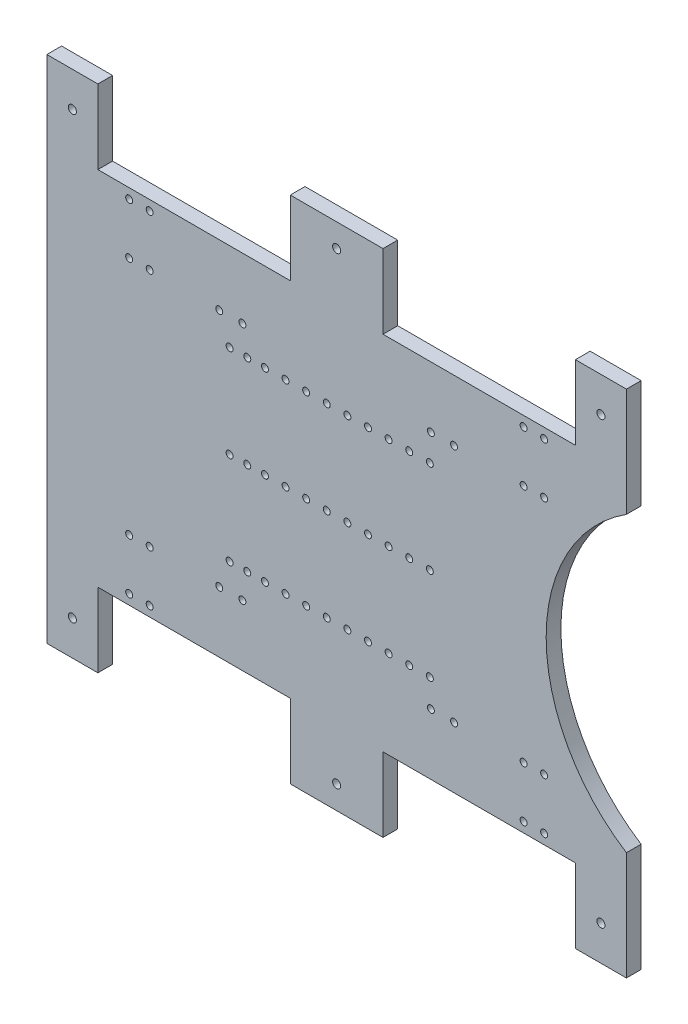
from build123d import *

# Parameters (mm, degrees)
SKETCH1_R           = 1.7525
SKETCH1_R_2         = 1.5
BOSS_EXTRUDE1_DEPTH = 6.35
SKETCH3_R           = 1.5
CUT_EXTRUDE2_DEPTH  = 10


with BuildPart() as part:
    # Sketch1 → Boss-Extrude1 (new body)
    with BuildSketch(Plane.XY):
        with BuildLine():
            Line((119.609790965, 110), (97.609790965, 110))
            Line((97.609790965, 110), (97.609790965, 78))
            Line((97.609790965, 78), (14.609790965, 78))
            Line((14.609790965, 78), (14.609790965, 110))
            Line((14.609790965, 110), (-25.390209035, 110))
            Line((-25.390209035, 110), (-25.390209035, 78))
            Line((-25.390209035, 78), (-108.390209035, 78))
            Line((-108.390209035, 78), (-108.390209035, 110))
            Line((-108.390209035, 110), (-130.390209035, 110))
            Line((-130.390209035, 110), (-130.390209035, -110))
            Line((-130.390209035, -110), (-108.390209035, -110))
            Line((-108.390209035, -110), (-108.390209035, -78))
            Line((-108.390209035, -78), (-25.390209035, -78))
            Line((-25.390209035, -78), (-25.390209035, -110))
            Line((-25.390209035, -110), (14.609790965, -110))
            Line((14.609790965, -110), (14.609790965, -78))
            Line((14.609790965, -78), (97.609790965, -78))
            Line((97.609790965, -78), (97.609790965, -110))
            Line((97.609790965, -110), (119.609790965, -110))
            Line((119.609790965, -110), (119.609790965, -63.2))
            ThreePointArc((119.609790965, -63.2), (84.992460515, 0), (119.609790965, 63.2))
            Line((119.609790965, 63.2), (119.609790965, 110))
        make_face()
        with Locations((-119.390209035, 95)):
            Circle(SKETCH1_R, mode=Mode.SUBTRACT)
        with Locations(Location((108.609790965, 95, 0), (0, 0, 180))):
            Circle(SKETCH1_R, mode=Mode.SUBTRACT)
        with Locations((-5.390209035, 100)):
            Circle(SKETCH1_R, mode=Mode.SUBTRACT)
        with Locations(Location((-5.390209035, -100, 0), (0, 0, 180))):
            Circle(SKETCH1_R, mode=Mode.SUBTRACT)
        with Locations((108.609790965, -95)):
            Circle(SKETCH1_R, mode=Mode.SUBTRACT)
        with Locations(Location((-119.390209035, -95, 0), (0, 0, 180))):
            Circle(SKETCH1_R, mode=Mode.SUBTRACT)
        with Locations((-36.311771099, 40)):
            Circle(SKETCH1_R_2, mode=Mode.SUBTRACT)
        with Locations((-36.311771099, 0)):
            Circle(SKETCH1_R_2, mode=Mode.SUBTRACT)
        with Locations(Location((-36.311771099, -40, 0), (0, 0, 180))):
            Circle(SKETCH1_R_2, mode=Mode.SUBTRACT)
        with Locations(Location((-27.421771099, -40, 0), (0, 0, 180))):
            Circle(SKETCH1_R_2, mode=Mode.SUBTRACT)
        with Locations((-27.421771099, 0)):
            Circle(SKETCH1_R_2, mode=Mode.SUBTRACT)
        with Locations((-27.421771099, 40)):
            Circle(SKETCH1_R_2, mode=Mode.SUBTRACT)
        with Locations(Location((-18.531771099, -40, 0), (0, 0, 180))):
            Circle(SKETCH1_R_2, mode=Mode.SUBTRACT)
        with Locations((-18.531771099, 0)):
            Circle(SKETCH1_R_2, mode=Mode.SUBTRACT)
        with Locations((-18.531771099, 40)):
            Circle(SKETCH1_R_2, mode=Mode.SUBTRACT)
        with Locations(Location((-9.641771099, -40, 0), (0, 0, 180))):
            Circle(SKETCH1_R_2, mode=Mode.SUBTRACT)
        with Locations((-9.641771099, 0)):
            Circle(SKETCH1_R_2, mode=Mode.SUBTRACT)
        with Locations((-9.641771099, 40)):
            Circle(SKETCH1_R_2, mode=Mode.SUBTRACT)
        with Locations(Location((-0.751771099, -40, 0), (0, 0, 180))):
            Circle(SKETCH1_R_2, mode=Mode.SUBTRACT)
        with Locations((-0.751771099, 0)):
            Circle(SKETCH1_R_2, mode=Mode.SUBTRACT)
        with Locations((-0.751771099, 40)):
            Circle(SKETCH1_R_2, mode=Mode.SUBTRACT)
        with Locations(Location((8.138228901, -40, 0), (0, 0, 180))):
            Circle(SKETCH1_R_2, mode=Mode.SUBTRACT)
        with Locations((8.138228901, 0)):
            Circle(SKETCH1_R_2, mode=Mode.SUBTRACT)
        with Locations((8.138228901, 40)):
            Circle(SKETCH1_R_2, mode=Mode.SUBTRACT)
        with Locations(Location((17.028228901, -40, 0), (0, 0, 180))):
            Circle(SKETCH1_R_2, mode=Mode.SUBTRACT)
        with Locations((17.028228901, 0)):
            Circle(SKETCH1_R_2, mode=Mode.SUBTRACT)
        with Locations((17.028228901, 40)):
            Circle(SKETCH1_R_2, mode=Mode.SUBTRACT)
        with Locations(Location((25.918228901, -40, 0), (0, 0, 180))):
            Circle(SKETCH1_R_2, mode=Mode.SUBTRACT)
        with Locations((25.918228901, 0)):
            Circle(SKETCH1_R_2, mode=Mode.SUBTRACT)
        with Locations((25.918228901, 40)):
            Circle(SKETCH1_R_2, mode=Mode.SUBTRACT)
        with Locations(Location((34.808228901, -40, 0), (0, 0, 180))):
            Circle(SKETCH1_R_2, mode=Mode.SUBTRACT)
        with Locations((34.808228901, 0)):
            Circle(SKETCH1_R_2, mode=Mode.SUBTRACT)
        with Locations((34.808228901, 40)):
            Circle(SKETCH1_R_2, mode=Mode.SUBTRACT)
        with Locations((-43.931771099, 0)):
            Circle(SKETCH1_R_2, mode=Mode.SUBTRACT)
        with Locations(Location((-43.931771099, -40, 0), (0, 0, 180))):
            Circle(SKETCH1_R_2, mode=Mode.SUBTRACT)
        with Locations((-43.931771099, 40)):
            Circle(SKETCH1_R_2, mode=Mode.SUBTRACT)
        with Locations((-51.551771099, 0)):
            Circle(SKETCH1_R_2, mode=Mode.SUBTRACT)
        with Locations(Location((-51.551771099, -40, 0), (0, 0, 180))):
            Circle(SKETCH1_R_2, mode=Mode.SUBTRACT)
        with Locations((-51.551771099, 40)):
            Circle(SKETCH1_R_2, mode=Mode.SUBTRACT)
    extrude(amount=BOSS_EXTRUDE1_DEPTH)

    # Sketch3 → Cut-Extrude2 (cut)
    with BuildSketch(Plane.XY.offset(6.35)):
        with Locations((-86.040209035, 73.7)):
            Circle(SKETCH3_R)
        with Locations((-86.040209035, 51.7)):
            Circle(SKETCH3_R)
        with Locations((-56.040209035, 51.7)):
            Circle(SKETCH3_R)
        with Locations(Location((-56.040209035, -51.7, 0), (0, 0, 180))):
            Circle(SKETCH3_R)
        with Locations(Location((-86.040209035, -51.7, 0), (0, 0, 180))):
            Circle(SKETCH3_R)
        with Locations(Location((-86.040209035, -73.7, 0), (0, 0, 180))):
            Circle(SKETCH3_R)
        with Locations((75.259790965, -73.7)):
            Circle(SKETCH3_R)
        with Locations((75.259790965, -51.7)):
            Circle(SKETCH3_R)
        with Locations((45.259790965, -51.7)):
            Circle(SKETCH3_R)
        with Locations(Location((45.259790965, 51.7, 0), (0, 0, 180))):
            Circle(SKETCH3_R)
        with Locations(Location((75.259790965, 51.7, 0), (0, 0, 180))):
            Circle(SKETCH3_R)
        with Locations(Location((75.259790965, 73.7, 0), (0, 0, 180))):
            Circle(SKETCH3_R)
        with Locations((-46.040209035, 51.7)):
            Circle(SKETCH3_R)
        with Locations((-94.890209035, 51.7)):
            Circle(SKETCH3_R)
        with Locations((-94.890209035, 73.7)):
            Circle(SKETCH3_R)
        with Locations(Location((-46.040209035, -51.7, 0), (0, 0, 180))):
            Circle(SKETCH3_R)
        with Locations(Location((-94.890209035, -51.7, 0), (0, 0, 180))):
            Circle(SKETCH3_R)
        with Locations(Location((-94.890209035, -73.7, 0), (0, 0, 180))):
            Circle(SKETCH3_R)
        with Locations(Location((35.259790965, 51.7, 0), (0, 0, 180))):
            Circle(SKETCH3_R)
        with Locations(Location((84.109790965, 51.7, 0), (0, 0, 180))):
            Circle(SKETCH3_R)
        with Locations(Location((84.109790965, 73.7, 0), (0, 0, 180))):
            Circle(SKETCH3_R)
        with Locations((84.109790965, -73.7)):
            Circle(SKETCH3_R)
        with Locations((35.259790965, -51.7)):
            Circle(SKETCH3_R)
        with Locations((84.109790965, -51.7)):
            Circle(SKETCH3_R)
    extrude(amount=-CUT_EXTRUDE2_DEPTH, mode=Mode.SUBTRACT)


solid = part.part
